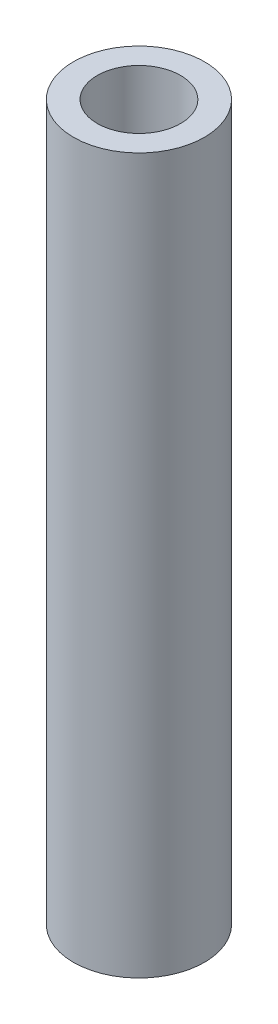
from build123d import *

# Parameters (mm, degrees)
SKETCH1_R           = 2.75
SKETCH1_R_2         = 1.75
BOSS_EXTRUDE1_DEPTH = 30


with BuildPart() as part:
    # Sketch1 → Boss-Extrude1 (new body)
    with BuildSketch(Plane(origin=(0, 0, 0), x_dir=(1, 0, 0), z_dir=(0, 1, 0))):
        Circle(SKETCH1_R)
        Circle(SKETCH1_R_2, mode=Mode.SUBTRACT)
    extrude(amount=BOSS_EXTRUDE1_DEPTH)


solid = part.part
